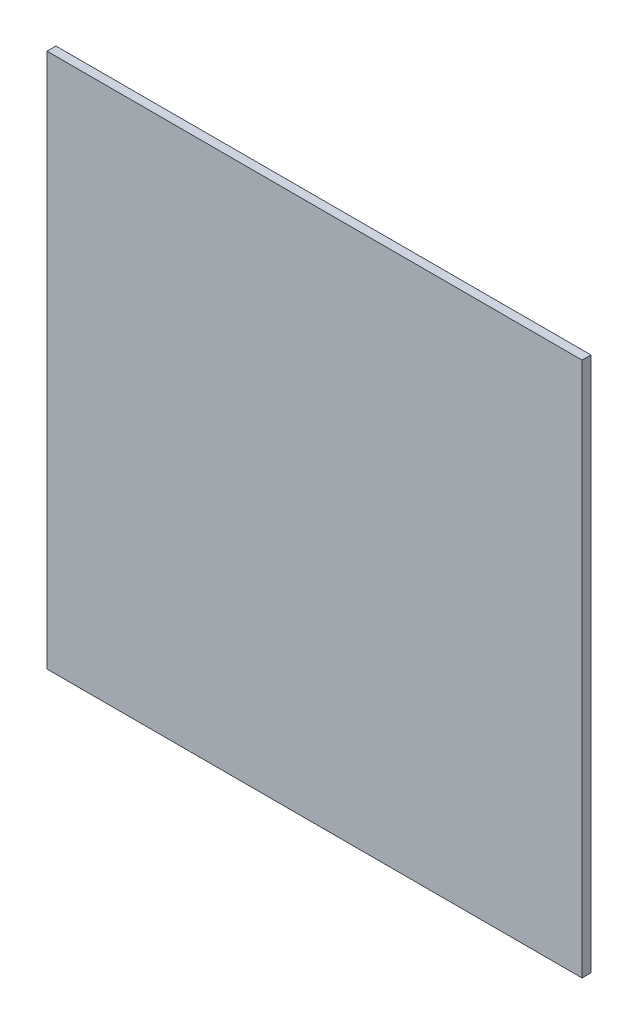
from build123d import *

# Parameters (mm, degrees)
SKETCH1_W           = 300
SKETCH1_H           = 300
BOSS_EXTRUDE1_DEPTH = 5


with BuildPart() as part:
    # Sketch1 → Boss-Extrude1 (new body)
    with BuildSketch(Plane.XY):
        Rectangle(SKETCH1_W, SKETCH1_H)
    extrude(amount=BOSS_EXTRUDE1_DEPTH)


solid = part.part
